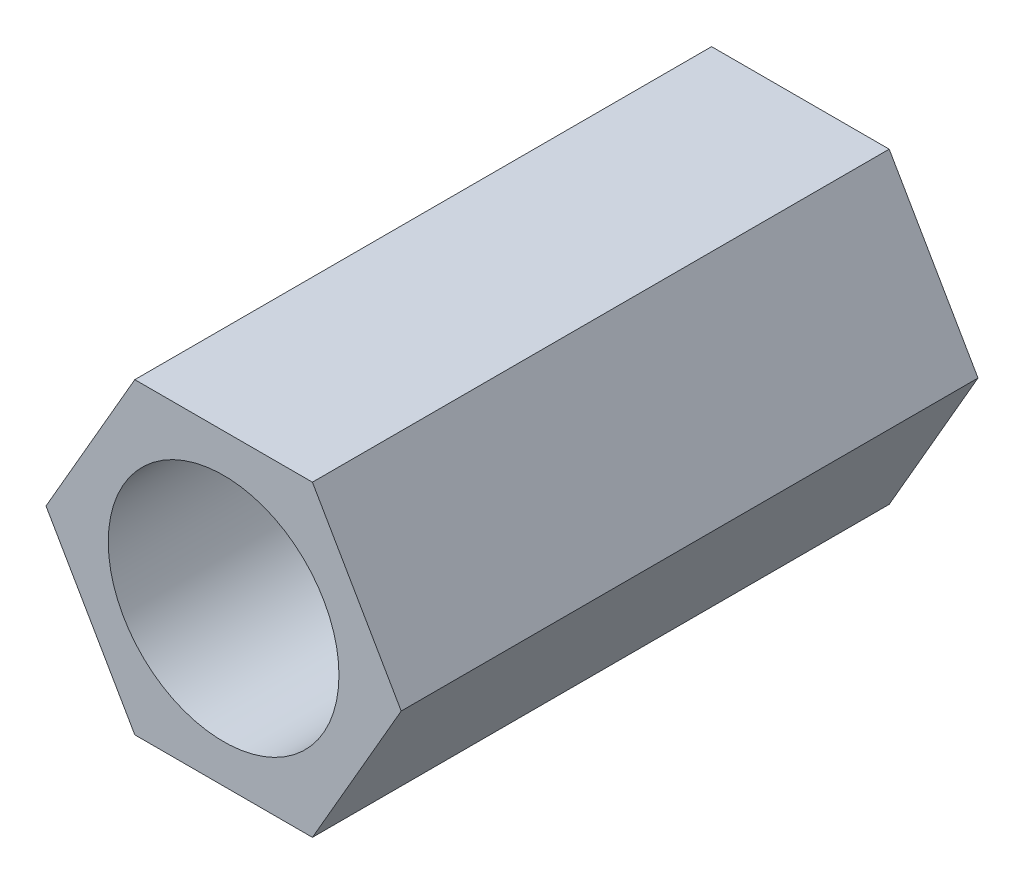
from build123d import *

# Parameters (mm, degrees)
SKETCH_1_R      = 1.5
EXTRUDE_1_DEPTH = 7.5


with BuildPart() as part:
    # 草图1 → 凸台-拉伸1 (new body)
    with BuildSketch(Plane.XY):
        Polygon((2.309401077, 0), (1.154700538, 2), (-1.154700538, 2), (-2.309401077, 0), (-1.154700538, -2), (1.154700538, -2), align=None)
        Circle(SKETCH_1_R, mode=Mode.SUBTRACT)
    extrude(amount=EXTRUDE_1_DEPTH)


solid = part.part
